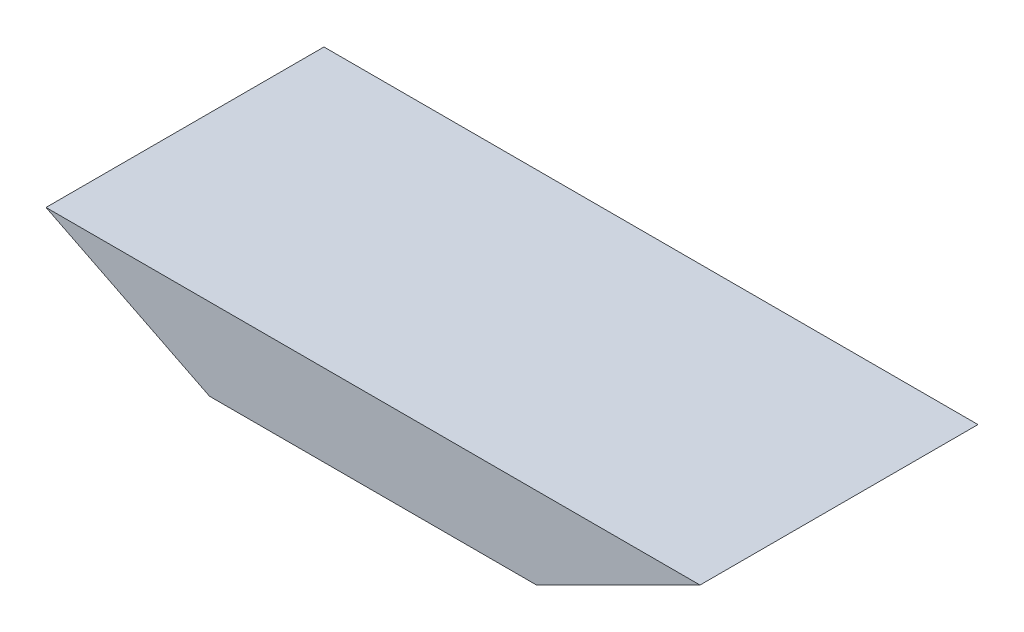
from build123d import *

# Parameters (mm, degrees)
CROQUIS1_W              = 40
CROQUIS1_H              = 17
SALIENTE_EXTRUIR1_DEPTH = 5
CORTAR_EXTRUIR1_DEPTH   = 40
SALIENTE_EXTRUIR2_DEPTH = 17
CORTAR_EXTRUIR2_DEPTH   = 17
SALIENTE_EXTRUIR3_DEPTH = 17


with BuildPart() as part:
    # Croquis1 → Saliente-Extruir1 (new body)
    with BuildSketch(Plane(origin=(0, 0, 0), x_dir=(1, 0, 0), z_dir=(0, 1, 0))):
        Rectangle(CROQUIS1_W, CROQUIS1_H)
    extrude(amount=SALIENTE_EXTRUIR1_DEPTH)

    # Croquis2 → Cortar-Extruir1 (cut)
    with BuildSketch(Plane.XY.offset(8.5)):
        Polygon((-20, 5), (-20, 0), (-10, 0), (-5, 5), align=None)
    extrude(amount=-CORTAR_EXTRUIR1_DEPTH, mode=Mode.SUBTRACT)

    # Croquis3 → Saliente-Extruir2 (add)
    with BuildSketch(Plane(origin=(0, 0, -8.5), x_dir=(-1, 0, 0), z_dir=(0, 0, -1))):
        Polygon((10, 5), (10, 0), (5, 5), align=None)
    extrude(amount=-SALIENTE_EXTRUIR2_DEPTH)

    # Croquis4 → Cortar-Extruir2 (cut)
    with BuildSketch(Plane(origin=(0, 0, -8.5), x_dir=(-1, 0, 0), z_dir=(0, 0, -1))):
        Polygon((10, 5), (0, 0), (10, 0), align=None)
    extrude(amount=-CORTAR_EXTRUIR2_DEPTH, mode=Mode.SUBTRACT)

    # Croquis5 → Saliente-Extruir3 (add)
    with BuildSketch(Plane(origin=(0, 0, -8.5), x_dir=(-1, 0, 0), z_dir=(0, 0, -1))):
        Polygon((-20, 5), (-30, 5), (-20, 0), align=None)
    extrude(amount=-SALIENTE_EXTRUIR3_DEPTH)


solid = part.part
